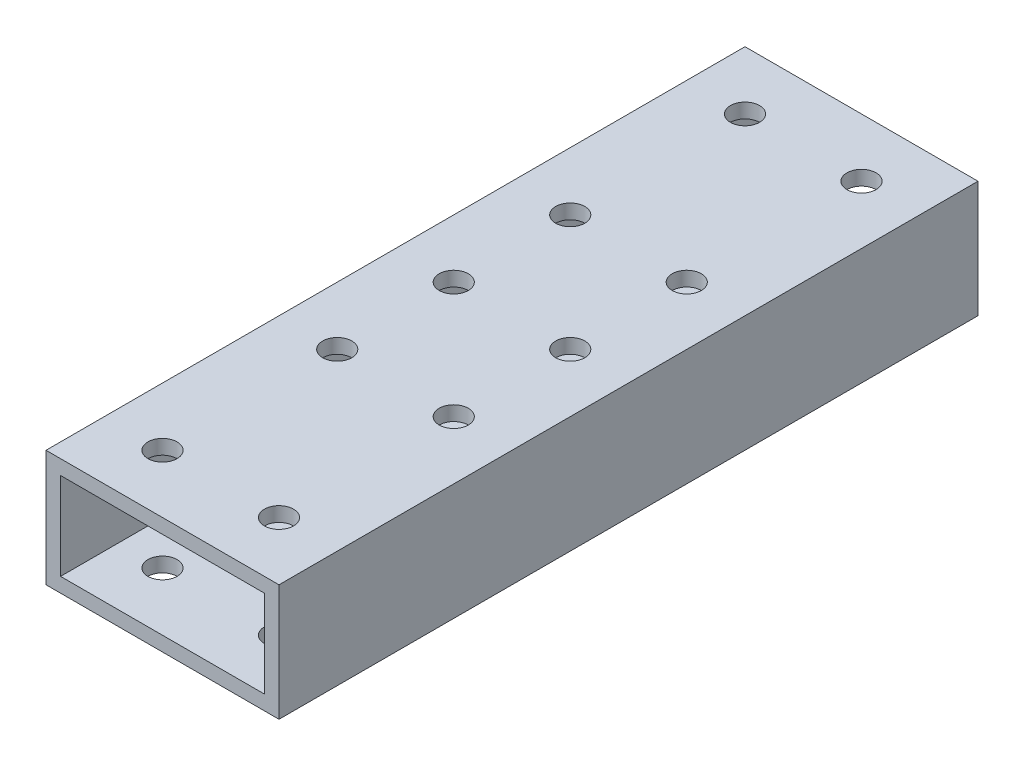
from build123d import *

# Parameters (mm, degrees)
SKETCH1_W               = 50.8
SKETCH1_H               = 25.4
SKETCH1_W_2             = 44.45
SKETCH1_H_2             = 19.05
BOSS_EXTRUDE1_DEPTH     = 152.4
CUT_EXTRUDE1_DEPTH      = 163.639355631
CUT_EXTRUDE1_DEPTH_BACK = 163.639355631
SKETCH2_R               = 3.175


with BuildPart() as part:
    # Sketch1 → Boss-Extrude1 (new body)
    with BuildSketch(Plane.XY):
        with Locations((25.4, 12.7)):
            Rectangle(SKETCH1_W, SKETCH1_H)
        with Locations((25.4, 12.7)):
            Rectangle(SKETCH1_W_2, SKETCH1_H_2, mode=Mode.SUBTRACT)
    extrude(amount=BOSS_EXTRUDE1_DEPTH)

    # Sketch2 → Cut-Extrude1 (cut, two sides: drawn at the far end of the back side and taken through both)
    with BuildSketch(Plane(origin=(0, 25.4, 0), x_dir=(1, 0, 0), z_dir=(0, 1, 0)).offset(-CUT_EXTRUDE1_DEPTH_BACK)):
        with Locations(Location((12.7, -12.7, 0), (0, 0, 270))):
            Circle(SKETCH2_R)
        with Locations(Location((12.7, -50.8, 0), (0, 0, 270))):
            Circle(SKETCH2_R)
        with Locations(Location((12.7, -76.2, 0), (0, 0, 270))):
            Circle(SKETCH2_R)
        with Locations(Location((12.7, -101.6, 0), (0, 0, 270))):
            Circle(SKETCH2_R)
        with Locations(Location((12.7, -139.7, 0), (0, 0, 270))):
            Circle(SKETCH2_R)
        with Locations(Location((38.1, -139.7, 0), (0, 0, 270))):
            Circle(SKETCH2_R)
        with Locations(Location((38.1, -101.6, 0), (0, 0, 270))):
            Circle(SKETCH2_R)
        with Locations(Location((38.1, -76.2, 0), (0, 0, 270))):
            Circle(SKETCH2_R)
        with Locations(Location((38.1, -12.7, 0), (0, 0, 270))):
            Circle(SKETCH2_R)
        with Locations(Location((38.1, -50.8, 0), (0, 0, 270))):
            Circle(SKETCH2_R)
    extrude(amount=CUT_EXTRUDE1_DEPTH + CUT_EXTRUDE1_DEPTH_BACK, mode=Mode.SUBTRACT)


solid = part.part
